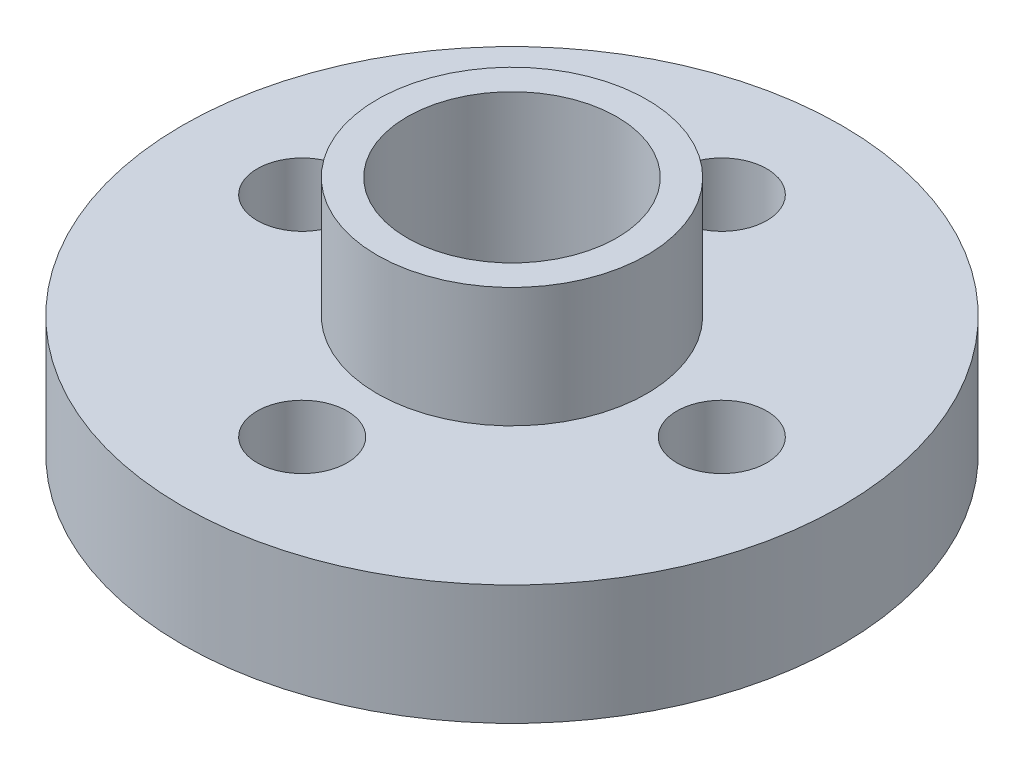
from build123d import *

# Parameters (mm, degrees)
SKETCH1_R           = 11
BOSS_EXTRUDE2_DEPTH = 8
SKETCH3_R           = 3
SKETCH3_R_2         = 1.5
CUT_EXTRUDE2_DEPTH  = 12
CUT_EXTRUDE3_START  = -4
SKETCH4_R           = 11
SKETCH4_R_2         = 4.5
CUT_EXTRUDE3_DEPTH  = 4
SKETCH6_R           = 3.5
CUT_EXTRUDE4_DEPTH  = 10


with BuildPart() as part:
    # Sketch1 → Boss-Extrude2 (new body)
    with BuildSketch(Plane(origin=(0, 0, 0), x_dir=(1, 0, 0), z_dir=(0, 1, 0))):
        with Locations(Location((0, 0, 0), (0, 0, 270))):
            Circle(SKETCH1_R)
    extrude(amount=BOSS_EXTRUDE2_DEPTH)

    # Sketch3 → Cut-Extrude2 (cut)
    with BuildSketch(Plane(origin=(0, 8, 0), x_dir=(1, 0, 0), z_dir=(0, 1, 0))):
        with Locations(Location((0, 0, 0), (0, 0, 270))):
            Circle(SKETCH3_R)
        with Locations(Location((-7, 0, 0), (0, 0, 270))):
            Circle(SKETCH3_R_2)
        with Locations(Location((0, 7, 0), (0, 0, 270))):
            Circle(SKETCH3_R_2)
        with Locations(Location((7, 0, 0), (0, 0, 270))):
            Circle(SKETCH3_R_2)
        with Locations(Location((0, -7, 0), (0, 0, 270))):
            Circle(SKETCH3_R_2)
    extrude(amount=-CUT_EXTRUDE2_DEPTH, mode=Mode.SUBTRACT)

    # Sketch4 → Cut-Extrude3 (cut)
    with BuildSketch(Plane(origin=(0, 8, 0), x_dir=(1, 0, 0), z_dir=(0, 1, 0)).offset(CUT_EXTRUDE3_START)):
        with Locations(Location((0, 0, 0), (0, 0, 270))):
            Circle(SKETCH4_R)
        with Locations(Location((0, 0, 0), (0, 0, 270))):
            Circle(SKETCH4_R_2, mode=Mode.SUBTRACT)
    extrude(amount=CUT_EXTRUDE3_DEPTH, mode=Mode.SUBTRACT)

    # Sketch6 → Cut-Extrude4 (cut)
    with BuildSketch(Plane(origin=(0, 8, 0), x_dir=(1, 0, 0), z_dir=(0, 1, 0))):
        with Locations(Location((0, 0, 0), (0, 0, 270))):
            Circle(SKETCH6_R)
    extrude(amount=-CUT_EXTRUDE4_DEPTH, mode=Mode.SUBTRACT)


solid = part.part
